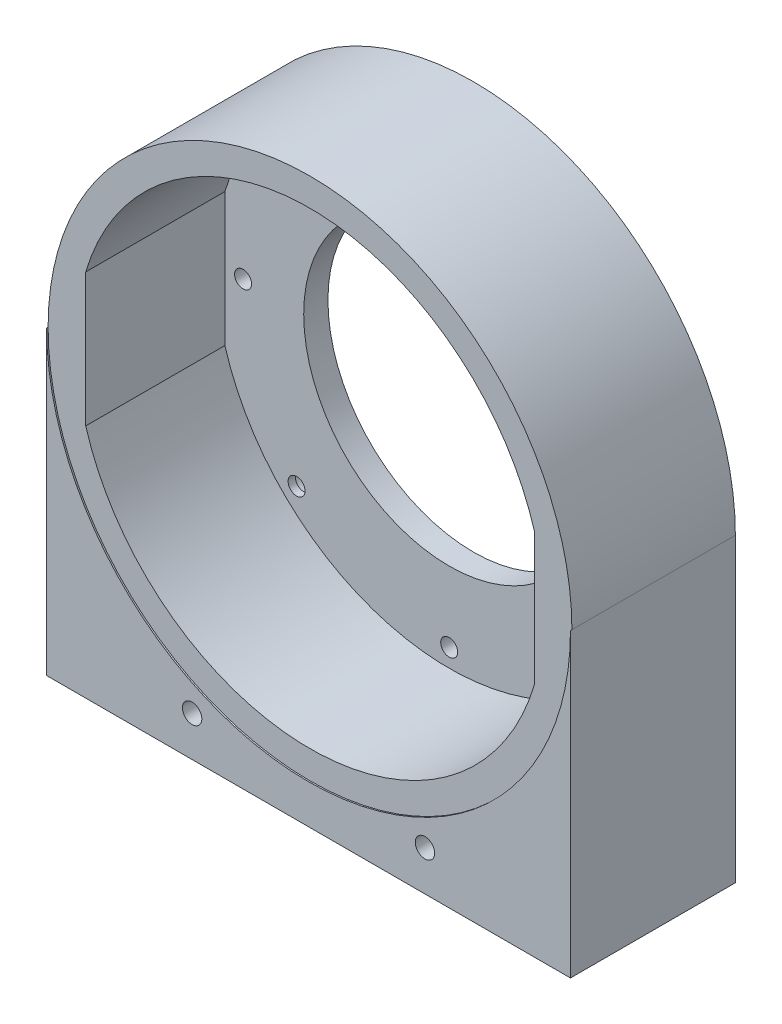
from build123d import *

# Parameters (mm, degrees)
SKETCH1_R           = 48.25
BOSS_EXTRUDE1_DEPTH = 5
SKETCH2_W           = 17.162038191
SKETCH2_H           = 56.822210482
SKETCH2_W_2         = 16.152506533
SKETCH2_H_2         = 65.186901365
CUT_EXTRUDE1_DEPTH  = 8
SKETCH3_R           = 30
CUT_EXTRUDE2_DEPTH  = 8
SKETCH4_R           = 1.75
CUT_EXTRUDE3_DEPTH  = 10
SKETCH6_R           = 1.75
CUT_EXTRUDE4_DEPTH  = 10
CIRPATTERN2_COUNT   = 2
CIRPATTERN2_ANGLE   = 45
CIRPATTERN3_COUNT   = 2
CIRPATTERN3_ANGLE   = 45
SKETCH7_R           = 1.75
CUT_EXTRUDE5_DEPTH  = 10
CIRPATTERN4_COUNT   = 2
CIRPATTERN4_ANGLE   = 45
CIRPATTERN5_COUNT   = 2
CIRPATTERN5_ANGLE   = 315
SKETCH8_R           = 54
BOSS_EXTRUDE3_DEPTH = 33.7
SKETCH10_R          = 3
CUT_EXTRUDE6_DEPTH  = 3.5
SKETCH12_R          = 3
CUT_EXTRUDE7_DEPTH  = 3.5
SKETCH11_R          = 3
CUT_EXTRUDE8_DEPTH  = 3.5
BOSS_EXTRUDE4_DEPTH = 34
SKETCH14_R          = 2
CUT_EXTRUDE9_DEPTH  = 34


with BuildPart() as part:
    # Sketch1 → Boss-Extrude1 (new body)
    with BuildSketch(Plane.XY):
        Circle(SKETCH1_R)
    extrude(amount=-BOSS_EXTRUDE1_DEPTH)

    # Sketch2 → Cut-Extrude1 (cut)
    with BuildSketch(Plane.XY):
        with Locations((-54.831019095, 0)):
            Rectangle(SKETCH2_W, SKETCH2_H)
        with Locations((54.326253267, -4.182345442)):
            Rectangle(SKETCH2_W_2, SKETCH2_H_2)
    extrude(amount=-CUT_EXTRUDE1_DEPTH, mode=Mode.SUBTRACT)

    # Sketch3 → Cut-Extrude2 (cut)
    with BuildSketch(Plane.XY):
        Circle(SKETCH3_R)
    extrude(amount=-CUT_EXTRUDE2_DEPTH, mode=Mode.SUBTRACT)

    # Sketch4 → Cut-Extrude3 (cut)
    with BuildSketch(Plane.XY):
        with Locations((-42.5, 0)):
            Circle(SKETCH4_R)
        with Locations((42.5, 0)):
            Circle(SKETCH4_R)
    extrude(amount=-CUT_EXTRUDE3_DEPTH, mode=Mode.SUBTRACT)

    # Sketch6 → Cut-Extrude4 (cut)
    with BuildSketch(Plane.XY):
        with Locations((0, 44.5)):
            Circle(SKETCH6_R)
    cut_extrude4 = extrude(amount=-CUT_EXTRUDE4_DEPTH, mode=Mode.SUBTRACT)

    # CirPattern2: Cut-Extrude4 ×2 about axis
    cirpattern2_axis = Axis((0, 0, -8), (0, 0, 1))
    for i in range(1, CIRPATTERN2_COUNT):
        add(cut_extrude4.rotate(cirpattern2_axis, i * CIRPATTERN2_ANGLE / (CIRPATTERN2_COUNT - 1)), mode=Mode.SUBTRACT)

    # CirPattern3: Cut-Extrude4 ×2 about axis
    cirpattern3_axis = Axis((0, 0, -8), (0, 0, -1))
    for i in range(1, CIRPATTERN3_COUNT):
        add(cut_extrude4.rotate(cirpattern3_axis, i * CIRPATTERN3_ANGLE / (CIRPATTERN3_COUNT - 1)), mode=Mode.SUBTRACT)

    # Sketch7 → Cut-Extrude5 (cut)
    with BuildSketch(Plane.XY):
        with Locations((0, -44.5)):
            Circle(SKETCH7_R)
    cut_extrude5 = extrude(amount=-CUT_EXTRUDE5_DEPTH, mode=Mode.SUBTRACT)

    # CirPattern4: Cut-Extrude5 ×2 about axis
    cirpattern4_axis = Axis((0, 0, -8), (0, 0, 1))
    for i in range(1, CIRPATTERN4_COUNT):
        add(cut_extrude5.rotate(cirpattern4_axis, i * CIRPATTERN4_ANGLE / (CIRPATTERN4_COUNT - 1)), mode=Mode.SUBTRACT)

    # CirPattern5: Cut-Extrude5 ×2 about axis
    cirpattern5_axis = Axis((0, 0, -8), (0, 0, 1))
    for i in range(1, CIRPATTERN5_COUNT):
        add(cut_extrude5.rotate(cirpattern5_axis, i * CIRPATTERN5_ANGLE / (CIRPATTERN5_COUNT - 1)), mode=Mode.SUBTRACT)

    # Sketch10 → Cut-Extrude6 (cut)
    with BuildSketch(Plane(origin=(0, 0, -5), x_dir=(-1, 0, 0), z_dir=(0, 0, -1))):
        with Locations((-31.466251763, 31.466251763)):
            Circle(SKETCH10_R)
    extrude(amount=-CUT_EXTRUDE6_DEPTH, mode=Mode.SUBTRACT)

    # Sketch12 → Cut-Extrude7 (cut)
    with BuildSketch(Plane(origin=(0, 0, -5), x_dir=(-1, 0, 0), z_dir=(0, 0, -1))):
        with Locations((-42.5, 0)):
            Circle(SKETCH12_R)
    extrude(amount=-CUT_EXTRUDE7_DEPTH, mode=Mode.SUBTRACT)

    # Sketch11 → Cut-Extrude8 (cut)
    with BuildSketch(Plane(origin=(0, 0, -5), x_dir=(-1, 0, 0), z_dir=(0, 0, -1))):
        with Locations((31.466251763, -31.466251763)):
            Circle(SKETCH11_R)
    extrude(amount=-CUT_EXTRUDE8_DEPTH, mode=Mode.SUBTRACT)


with BuildPart() as body_2:
    # Sketch8 → Boss-Extrude3 (new body)
    with BuildSketch(Plane(origin=(0, 0, -5), x_dir=(-1, 0, 0), z_dir=(0, 0, -1))):
        Circle(SKETCH8_R)
        with BuildLine():
            Line((-46.25, 13.747727085), (-46.25, -13.747727085))
            ThreePointArc((-46.25, -13.747727085), (0, -48.25), (46.25, -13.747727085))
            Line((46.25, -13.747727085), (46.25, 13.747727085))
            ThreePointArc((46.25, 13.747727085), (0, 48.25), (-46.25, 13.747727085))
        make_face(mode=Mode.SUBTRACT)
    extrude(amount=-BOSS_EXTRUDE3_DEPTH)


    add(part.part)  # Boss-Extrude4 merges part
    # Sketch13 → Boss-Extrude4 (add)
    with BuildSketch(Plane(origin=(0, 0, -5), x_dir=(-1, 0, 0), z_dir=(0, 0, -1))):
        with BuildLine():
            Line((-54, 0), (-54, -62.045472978))
            Line((-54, -62.045472978), (54, -62.045472978))
            Line((54, -62.045472978), (54, 0))
            ThreePointArc((54, 0), (0, -54), (-54, 0))
        make_face()
    extrude(amount=-BOSS_EXTRUDE4_DEPTH)

    # Sketch14 → Cut-Extrude9 (cut)
    with BuildSketch(Plane(origin=(0, 0, -5), x_dir=(-1, 0, 0), z_dir=(0, 0, -1))):
        with Locations((-24, -53.783750327)):
            Circle(SKETCH14_R)
        with Locations((24, -53.783750327)):
            Circle(SKETCH14_R)
    extrude(amount=-CUT_EXTRUDE9_DEPTH, mode=Mode.SUBTRACT)


solid = body_2.part
